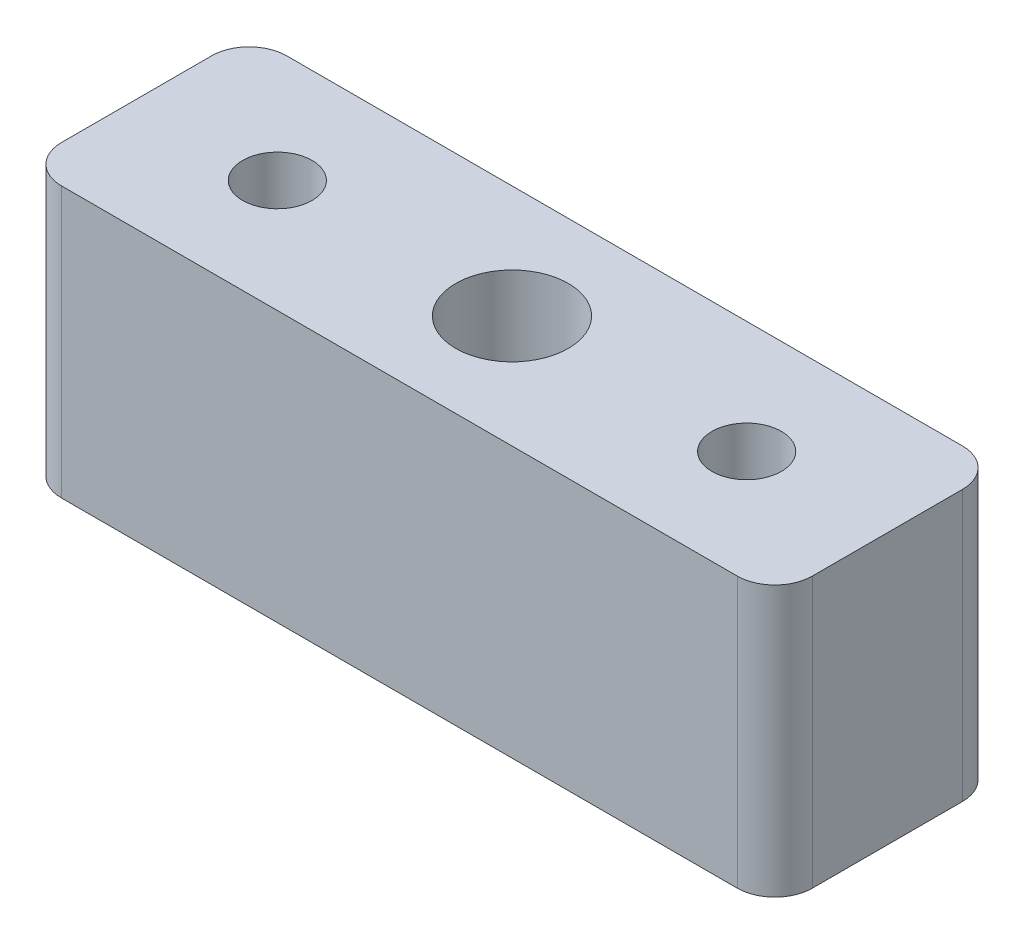
from build123d import *

# Parameters (mm, degrees)
SKETCH_1_W          = 40
SKETCH_1_H          = 12
SKETCH_1_R          = 1.85
EXTRUDE_1_DEPTH     = 14.4
FILLET_1_R          = 2
SKETCH_2_R          = 3
CUT_EXTRUDE_1_DEPTH = 20


with BuildPart() as part:
    # 草图1 → 凸台-拉伸1 (new body)
    with BuildSketch(Plane(origin=(0, 0, 0), x_dir=(1, 0, 0), z_dir=(0, 1, 0))):
        Rectangle(SKETCH_1_W, SKETCH_1_H)
        with Locations(Location((-12.5, 0, 0), (0, 0, 270))):
            Circle(SKETCH_1_R, mode=Mode.SUBTRACT)
        with Locations(Location((12.5, 0, 0), (0, 0, 270))):
            Circle(SKETCH_1_R, mode=Mode.SUBTRACT)
    extrude(amount=EXTRUDE_1_DEPTH)

    # 圆角1
    fillet_1_edges = [part.edges().sort_by_distance(p)[0] for p in [
        (20, 7.2, 6),
        (-20, 7.2, 6),
        (-20, 7.2, -6),
        (20, 7.2, -6),
    ]]
    fillet(fillet_1_edges, radius=FILLET_1_R)

    # 草图2 → 切除-拉伸1 (cut)
    with BuildSketch(Plane(origin=(0, 14.4, 0), x_dir=(1, 0, 0), z_dir=(0, 1, 0))):
        with Locations(Location((0, 0, 0), (0, 0, 270))):
            Circle(SKETCH_2_R)
    extrude(amount=-CUT_EXTRUDE_1_DEPTH, mode=Mode.SUBTRACT)


solid = part.part
